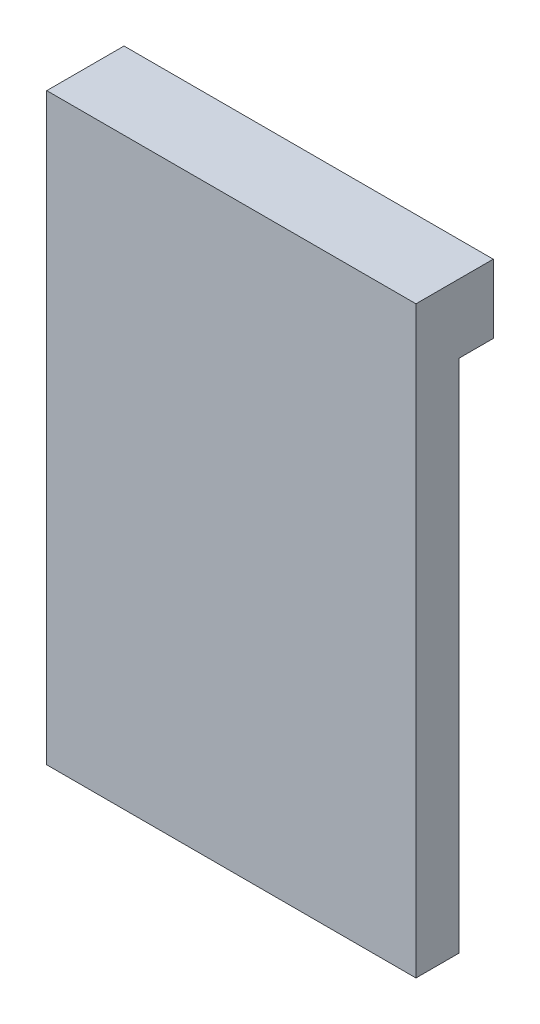
from build123d import *

# Parameters (mm, degrees)
SASE_TABAN1_W               = 80
SASE_TABAN1_H               = 130
Y_KSEKLIK_EKSTR_ZYON4_DEPTH = 3
SASE_TABAN1_5_W             = 86
SASE_TABAN1_5_H             = 136
SASE_TABAN1_5_W_2           = 80
SASE_TABAN1_5_H_2           = 130
Y_KSEKLIK_EKSTR_ZYON5_DEPTH = 10
Y_KSEKLIK_EKSTR_ZYON6_REACH = 138.755
KES_EKSTR_ZYON1_START       = -13
EKLEM_ORTA_W                = 36
EKLEM_ORTA_H                = 15
KES_EKSTR_ZYON1_DEPTH       = 13
KES_EKSTR_ZYON3_DEPTH       = 42
KES_EKSTR_ZYON4_START       = -6
KES_EKSTR_ZYON4_DEPTH       = 6
Y_KSEKLIK_EKSTR_ZYON7_START = -3
Y_KSEKLIK_EKSTR_ZYON7_DEPTH = 3
Y_KSEKLIK_EKSTR_ZYON8_DEPTH = 3


with BuildPart() as part:
    # sase_taban1 → Yükseklik-Ekstrüzyon4 (new body)
    with BuildSketch(Plane.XY):
        with Locations((1.981566113, 37.857486255)):
            Rectangle(SASE_TABAN1_W, SASE_TABAN1_H)
    extrude(amount=-Y_KSEKLIK_EKSTR_ZYON4_DEPTH)

    # sase_taban1<5> → Yükseklik-Ekstrüzyon5 (add)
    with BuildSketch(Plane.XY):
        with Locations((1.981566113, 37.857486255)):
            Rectangle(SASE_TABAN1_5_W, SASE_TABAN1_5_H)
        with Locations((1.981566113, 37.857486255)):
            Rectangle(SASE_TABAN1_5_W_2, SASE_TABAN1_5_H_2, mode=Mode.SUBTRACT)
    extrude(amount=-Y_KSEKLIK_EKSTR_ZYON5_DEPTH)

    # Yükseklik-Ekstrüzyon6: up to this face of the body (flat: up to its plane)
    y_kseklik_ekstr_zyon6_end = Plane(part.part.faces().sort_by_distance((-41.018433887, 37.857486255, -5))[0])
    # sase_eklem1 → Yükseklik-Ekstrüzyon6 (add, up to the picked face)
    with BuildSketch(Plane(origin=(44.981566113, 0, 0), x_dir=(0, 0, -1), z_dir=(1, 0, 0)), mode=Mode.PRIVATE) as y_kseklik_ekstr_zyon6_sk1:
        with BuildLine():
            Line((18, 105.857486255), (0, 105.857486255))
            Line((0, 105.857486255), (0, 97.857486255))
            Line((0, 97.857486255), (10, 89.857486255))
            Line((10, 89.857486255), (18, 89.857486255))
            Line((18, 89.857486255), (18, 92.857486255))
            ThreePointArc((18, 92.857486255), (13, 97.857486255), (18, 102.857486255))
            Line((18, 102.857486255), (18, 105.857486255))
        make_face()
    y_kseklik_ekstr_zyon6_tool1 = split(extrude(y_kseklik_ekstr_zyon6_sk1.sketch, amount=-Y_KSEKLIK_EKSTR_ZYON6_REACH, mode=Mode.PRIVATE), bisect_by=y_kseklik_ekstr_zyon6_end, keep=Keep.BOTH, mode=Mode.PRIVATE)
    add(y_kseklik_ekstr_zyon6_tool1.solids().sort_by(Axis((44.981566, 98.87954, -8.791936), (-1, 0, 0)))[0])

    # eklem_orta → Kes-Ekstrüzyon1 (cut)
    with BuildSketch(Plane.XZ.offset(-89.857486255).offset(KES_EKSTR_ZYON1_START)):
        with Locations((1.981566113, -10.5)):
            Rectangle(EKLEM_ORTA_W, EKLEM_ORTA_H)
    extrude(amount=KES_EKSTR_ZYON1_DEPTH, mode=Mode.SUBTRACT)

    # eklem_kablo → Kes-Ekstrüzyon3 (cut)
    with BuildSketch(Plane.ZY.offset(-19.981566113)):
        with BuildLine():
            Line((-5, 93.857486255), (-8.123475238, 91.358706065))
            ThreePointArc((-8.123475238, 91.358706065), (-10.068499616, 94.506792744), (-13.669872981, 95.357486255))
            ThreePointArc((-13.669872981, 95.357486255), (-13, 97.857486255), (-13.669872981, 100.357486255))
            ThreePointArc((-13.669872981, 100.357486255), (-7.988742413, 98.903075741), (-5, 93.857486255))
        make_face()
    extrude(amount=KES_EKSTR_ZYON3_DEPTH, mode=Mode.SUBTRACT)

    # eklem_kablo<2> → Kes-Ekstrüzyon4 (cut)
    with BuildSketch(Plane.ZY.offset(-19.981566113).offset(KES_EKSTR_ZYON4_START)):
        with BuildLine():
            Line((-8.123475238, 91.358706065), (-5, 93.857486255))
            ThreePointArc((-5, 93.857486255), (-7.988742413, 98.903075741), (-13.669872981, 100.357486255))
            ThreePointArc((-13.669872981, 100.357486255), (-13, 97.857486255), (-13.669872981, 95.357486255))
            ThreePointArc((-13.669872981, 95.357486255), (-10.068499616, 94.506792744), (-8.123475238, 91.358706065))
        make_face()
    extrude(amount=KES_EKSTR_ZYON4_DEPTH, mode=Mode.SUBTRACT)

    # eklem_sag_kapak → Yükseklik-Ekstrüzyon7 (add)
    with BuildSketch(Plane.ZY.offset(41.018433887).offset(Y_KSEKLIK_EKSTR_ZYON7_START)):
        with BuildLine():
            Line((-18, 102.857486255), (-18, 92.857486255))
            ThreePointArc((-18, 92.857486255), (-13, 97.857486255), (-18, 102.857486255))
        make_face()
    extrude(amount=Y_KSEKLIK_EKSTR_ZYON7_DEPTH)

    # eklem_sol_kapak → Yükseklik-Ekstrüzyon8 (add)
    with BuildSketch(Plane(origin=(44.981566113, 0, 0), x_dir=(0, 0, -1), z_dir=(1, 0, 0))):
        with BuildLine():
            Line((18, 102.857486255), (18, 92.857486255))
            ThreePointArc((18, 92.857486255), (13, 97.857486255), (18, 102.857486255))
        make_face()
    extrude(amount=-Y_KSEKLIK_EKSTR_ZYON8_DEPTH)


solid = part.part
